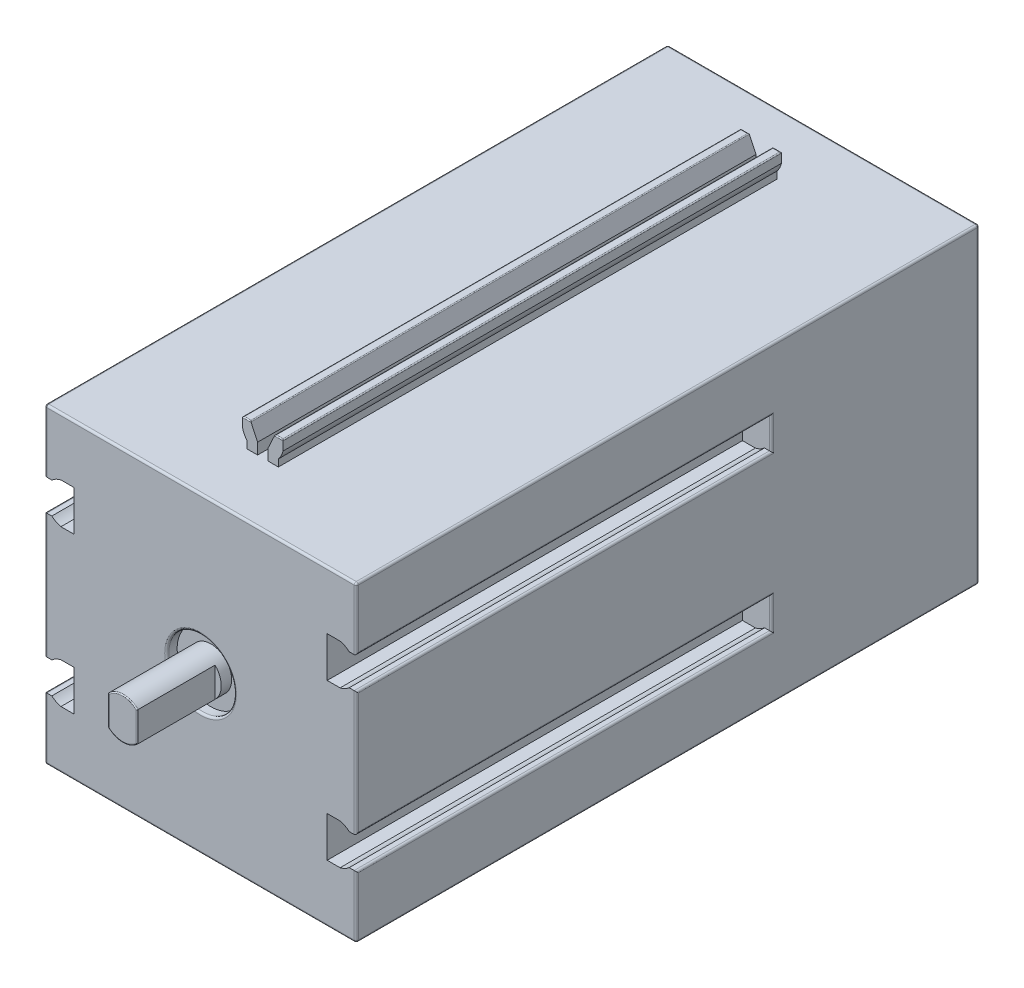
from build123d import *

# Parameters (mm, degrees)
SKETCH_1_W          = 30
SKETCH_1_H          = 30
EXTRUDE_1_DEPTH     = 60
CUT_EXTRUDE_1_DEPTH = 54.5
CUT_EXTRUDE_START   = -60
CUT_EXTRUDE_2_DEPTH = 40
EXTRUDE_START       = -6
EXTRUDE_2_DEPTH     = 48
FILLET_1_R          = 0.1
SKETCH_6_R          = 3.25
CUT_EXTRUDE_3_DEPTH = 1
SKETCH_7_R          = 2
EXTRUDE_3_DEPTH     = 8.5
CUT_EXTRUDE_START_2 = -7.5
CUT_EXTRUDE_5_DEPTH = 7.5
SKETCH_10_R         = 1.25
CUT_EXTRUDE_6_DEPTH = 5
CUT_EXTRUDE_7_DEPTH = 5
FILLET_2_R          = 0.2
FILLET_3_R          = 0.1


with BuildPart() as part:
    # 草图1 → 凸台-拉伸1 (new body)
    with BuildSketch(Plane.XY):
        with Locations((0, 15)):
            Rectangle(SKETCH_1_W, SKETCH_1_H)
    extrude(amount=-EXTRUDE_1_DEPTH)

    # 草图2 → 切除-拉伸1 (cut)
    with BuildSketch(Plane(origin=(0, 0, -60), x_dir=(-1, 0, 0), z_dir=(0, 0, -1))):
        with BuildLine():
            Line((-9, 0.677124344), (-9, 0))
            Line((-9, 0), (-6, 0))
            Line((-6, 0), (-6, 0.677124344))
            ThreePointArc((-6, 0.677124344), (-5.719957697, 1.088161527), (-5.55, 1.555590279))
            Line((-5.55, 1.555590279), (-5.55, 2.8))
            Line((-5.55, 2.8), (-9.45, 2.8))
            Line((-9.45, 2.8), (-9.45, 1.555590279))
            ThreePointArc((-9.45, 1.555590279), (-9.280042303, 1.088161527), (-9, 0.677124344))
        make_face()
        with BuildLine():
            Line((5.55, 2.8), (5.55, 1.555590279))
            ThreePointArc((5.55, 1.555590279), (5.719957697, 1.088161527), (6, 0.677124344))
            Line((6, 0.677124344), (6, 0))
            Line((6, 0), (9, 0))
            Line((9, 0), (9, 0.677124344))
            ThreePointArc((9, 0.677124344), (9.280042303, 1.088161527), (9.45, 1.555590279))
            Line((9.45, 1.555590279), (9.45, 2.8))
            Line((9.45, 2.8), (5.55, 2.8))
        make_face()
    extrude(amount=-CUT_EXTRUDE_1_DEPTH, mode=Mode.SUBTRACT)

    # 草图3 → 切除-拉伸2 (cut)
    with BuildSketch(Plane(origin=(0, 0, -60), x_dir=(-1, 0, 0), z_dir=(0, 0, -1)).offset(CUT_EXTRUDE_START)):
        with BuildLine():
            Line((-14.322875656, 9), (-15, 9))
            Line((-15, 9), (-15, 6))
            Line((-15, 6), (-14.322875656, 6))
            ThreePointArc((-14.322875656, 6), (-13.911838473, 5.719957697), (-13.444409721, 5.55))
            Line((-13.444409721, 5.55), (-12.2, 5.55))
            Line((-12.2, 5.55), (-12.2, 9.45))
            Line((-12.2, 9.45), (-13.444409721, 9.45))
            ThreePointArc((-13.444409721, 9.45), (-13.911838473, 9.280042303), (-14.322875656, 9))
        make_face()
        with BuildLine():
            Line((-12.2, 20.55), (-13.444409721, 20.55))
            ThreePointArc((-13.444409721, 20.55), (-13.911838473, 20.719957697), (-14.322875656, 21))
            Line((-14.322875656, 21), (-15, 21))
            Line((-15, 21), (-15, 24))
            Line((-15, 24), (-14.322875656, 24))
            ThreePointArc((-14.322875656, 24), (-13.911838473, 24.280042303), (-13.444409721, 24.45))
            Line((-13.444409721, 24.45), (-12.2, 24.45))
            Line((-12.2, 24.45), (-12.2, 20.55))
        make_face()
        with BuildLine():
            Line((14.322875656, 21), (15, 21))
            Line((15, 21), (15, 24))
            Line((15, 24), (14.322875656, 24))
            ThreePointArc((14.322875656, 24), (13.911838473, 24.280042303), (13.444409721, 24.45))
            Line((13.444409721, 24.45), (12.2, 24.45))
            Line((12.2, 24.45), (12.2, 20.55))
            Line((12.2, 20.55), (13.444409721, 20.55))
            ThreePointArc((13.444409721, 20.55), (13.911838473, 20.719957697), (14.322875656, 21))
        make_face()
        with BuildLine():
            Line((12.2, 9.45), (13.444409721, 9.45))
            ThreePointArc((13.444409721, 9.45), (13.911838473, 9.280042303), (14.322875656, 9))
            Line((14.322875656, 9), (15, 9))
            Line((15, 9), (15, 6))
            Line((15, 6), (14.322875656, 6))
            ThreePointArc((14.322875656, 6), (13.911838473, 5.719957697), (13.444409721, 5.55))
            Line((13.444409721, 5.55), (12.2, 5.55))
            Line((12.2, 5.55), (12.2, 9.45))
        make_face()
    extrude(amount=CUT_EXTRUDE_2_DEPTH, mode=Mode.SUBTRACT)

    # 草图5 → 凸台-拉伸2 (add)
    with BuildSketch(Plane(origin=(0, 0, -60), x_dir=(-1, 0, 0), z_dir=(0, 0, -1)).offset(EXTRUDE_START)):
        with BuildLine():
            Line((-1.5, 30.677124344), (-1.5, 30))
            Line((-1.5, 30), (-0.5, 30))
            Line((-0.5, 30), (-0.5, 31.07225346))
            Line((-0.5, 31.07225346), (-1.165769145, 32.5))
            Line((-1.165769145, 32.5), (-1.95, 32.5))
            Line((-1.95, 32.5), (-1.95, 31.555590279))
            ThreePointArc((-1.95, 31.555590279), (-1.780042303, 31.088161527), (-1.5, 30.677124344))
        make_face()
        with BuildLine():
            Line((1.5, 30), (1.5, 30.677124344))
            ThreePointArc((1.5, 30.677124344), (1.780042303, 31.088161527), (1.95, 31.555590279))
            Line((1.95, 31.555590279), (1.95, 32.5))
            Line((1.95, 32.5), (1.165769145, 32.5))
            Line((1.165769145, 32.5), (0.5, 31.07225346))
            Line((0.5, 31.07225346), (0.5, 30))
            Line((0.5, 30), (1.5, 30))
        make_face()
    extrude(amount=-EXTRUDE_2_DEPTH)

    # 圆角1
    fillet_1_edges = [part.edges().sort_by_distance(p)[0] for p in [
        (1.557884573, 32.5, -6),
        (1.95, 32.5, -30),
        (1.165769145, 32.5, -30),
        (1.557884573, 32.5, -54),
        (-1.557884573, 32.5, -6),
        (-1.165769145, 32.5, -30),
        (-1.95, 32.5, -30),
        (-1.557884573, 32.5, -54),
    ]]
    fillet(fillet_1_edges, radius=FILLET_1_R)

    # 草图6 → 切除-拉伸3 (cut)
    with BuildSketch(Plane.XY):
        with Locations((0, 15)):
            Circle(SKETCH_6_R)
    extrude(amount=-CUT_EXTRUDE_3_DEPTH, mode=Mode.SUBTRACT)

    # 草图7 → 凸台-拉伸3 (add)
    with BuildSketch(Plane.XY.offset(-1)):
        with Locations((0, 15)):
            Circle(SKETCH_7_R)
    extrude(amount=EXTRUDE_3_DEPTH)

    # 草图9 → 切除-拉伸5 (cut)
    with BuildSketch(Plane.XY.offset(7.5).offset(CUT_EXTRUDE_START_2)):
        with BuildLine():
            Line((-1.4, 16.428285686), (-1.4, 13.571714314))
            ThreePointArc((-1.4, 13.571714314), (-2, 15), (-1.4, 16.428285686))
        make_face()
        with BuildLine():
            Line((1.4, 16.428285686), (1.4, 13.571714314))
            ThreePointArc((1.4, 13.571714314), (2, 15), (1.4, 16.428285686))
        make_face()
    extrude(amount=CUT_EXTRUDE_5_DEPTH, mode=Mode.SUBTRACT)

    # 草图10 → 切除-拉伸6 (cut)
    with BuildSketch(Plane(origin=(0, 0, -60), x_dir=(-1, 0, 0), z_dir=(0, 0, -1))):
        with Locations((-10.5, 25.5)):
            Circle(SKETCH_10_R)
        with Locations((10.5, 25.5)):
            Circle(SKETCH_10_R)
    extrude(amount=-CUT_EXTRUDE_6_DEPTH, mode=Mode.SUBTRACT)

    # 草图11 → 切除-拉伸7 (cut)
    with BuildSketch(Plane(origin=(0, 0, -60), x_dir=(-1, 0, 0), z_dir=(0, 0, -1))):
        Polygon((2.5, 24), (4, 24), (4, 27), (-4, 27), (-4, 24), (-2.5, 24), (-2.5, 25), (2.5, 25), align=None)
    extrude(amount=-CUT_EXTRUDE_7_DEPTH, mode=Mode.SUBTRACT)

    # 圆角2
    fillet_2_edges = [part.edges().sort_by_distance(p)[0] for p in [
        (15, 15, -60),
        (-15, 15, 0),
        (-15, 21, -20),
        (-15, 24, -20),
        (-15, 22.5, -40),
        (-15, 3, 0),
        (0, 30, -60),
        (-15, 6, -20),
        (-15, 9, -20),
        (-15, 7.5, -40),
        (12, 0, -60),
        (7.5, 0, -5.5),
        (6, 0, -32.75),
        (9, 0, -32.75),
        (-3.25, 15, 0),
        (0, 0, -60),
        (-15, 15, -60),
        (-7.5, 0, -5.5),
        (-9, 0, -32.75),
        (-6, 0, -32.75),
        (0, 30, 0),
        (15, 3, 0),
        (0, 0, 0),
        (-15, 27, 0),
        (15, 15, 0),
        (15, 9, -20),
        (15, 6, -20),
        (-12, 0, -60),
        (15, 7.5, -40),
        (-15, 30, -30),
        (15, 30, -30),
        (15, 0, -30),
        (-15, 0, -30),
        (15, 27, 0),
        (15, 24, -20),
        (15, 21, -20),
        (15, 22.5, -40),
    ]]
    fillet(fillet_2_edges, radius=FILLET_2_R)

    # 圆角3
    fillet_3_edges = [part.edges().sort_by_distance(p)[0] for p in [
        (0, 17, 7.5),
        (1.4, 15, 7.5),
        (0, 13, 7.5),
        (-1.4, 15, 7.5),
    ]]
    fillet(fillet_3_edges, radius=FILLET_3_R)


solid = part.part
